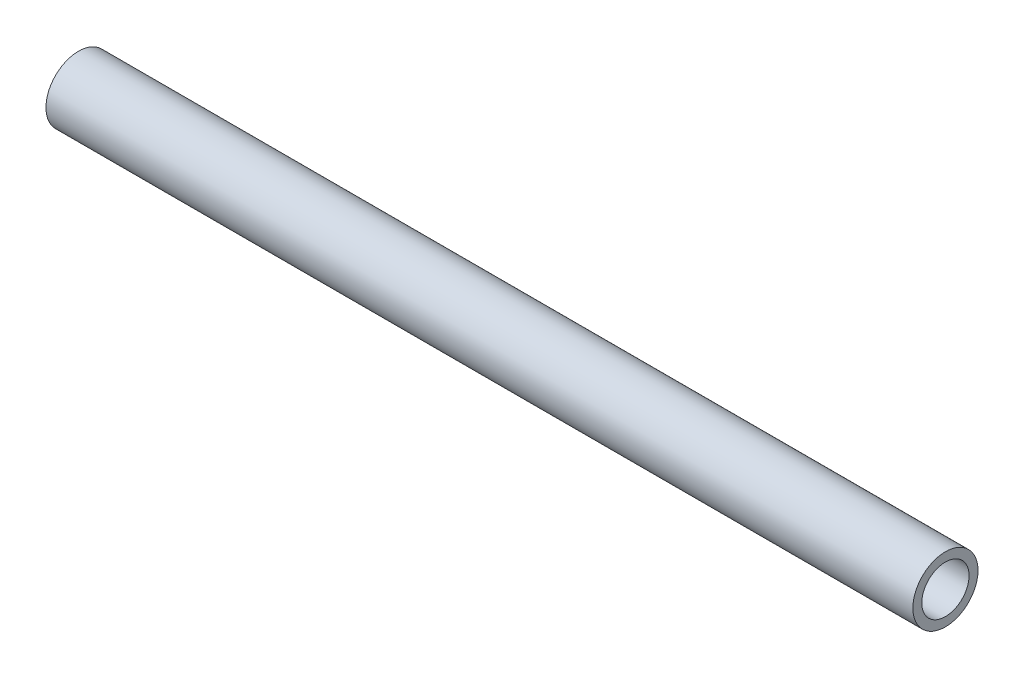
from build123d import *

# Parameters (mm, degrees)
SKETCH1_R           = 13.15
SKETCH1_R_2         = 9.55
BOSS_EXTRUDE1_DEPTH = 350


with BuildPart() as part:
    # Sketch1 → Boss-Extrude1 (new body)
    with BuildSketch(Plane(origin=(0, 0, 0), x_dir=(0, 0, -1), z_dir=(1, 0, 0))):
        Circle(SKETCH1_R)
        Circle(SKETCH1_R_2, mode=Mode.SUBTRACT)
    extrude(amount=BOSS_EXTRUDE1_DEPTH)


solid = part.part
